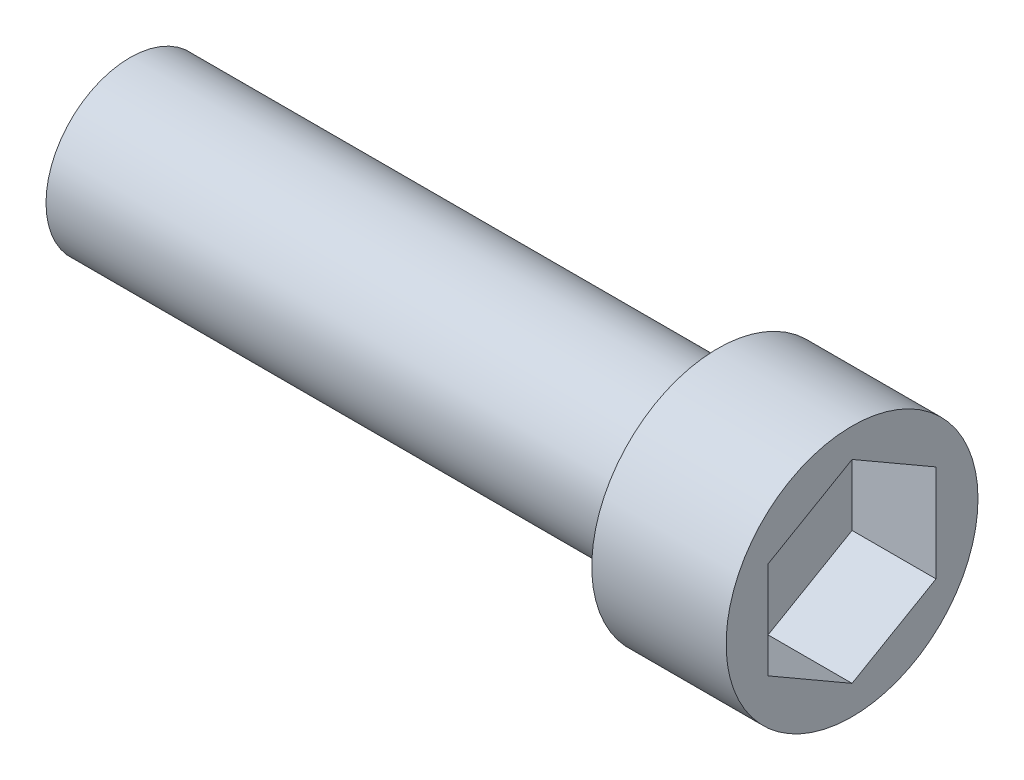
from build123d import *

# Parameters (mm, degrees)
SKETCH1_R           = 7.5
BOSS_EXTRUDE1_DEPTH = 8
CUT_EXTRUDE1_DEPTH  = 5
SKETCH3_R           = 5
SKETCH3_R_2         = 3.31
EXTRUDE_THIN1_DEPTH = 35


with BuildPart() as part:
    # Sketch1 → Boss-Extrude1 (new body)
    with BuildSketch(Plane(origin=(0, 0, 0), x_dir=(0, 0, -1), z_dir=(1, 0, 0))):
        Circle(SKETCH1_R)
    extrude(amount=BOSS_EXTRUDE1_DEPTH)

    # Sketch2 → Cut-Extrude1 (cut)
    with BuildSketch(Plane(origin=(8, 0, 0), x_dir=(0, 0, -1), z_dir=(1, 0, 0))):
        Polygon((0, -5.773502692), (5, -2.886751346), (5, 2.886751346), (0, 5.773502692), (-5, 2.886751346), (-5, -2.886751346), align=None)
    extrude(amount=-CUT_EXTRUDE1_DEPTH, mode=Mode.SUBTRACT)

    # Sketch3 → Extrude-Thin1 (add)
    with BuildSketch(Plane.ZY):
        Circle(SKETCH3_R)
        Circle(SKETCH3_R_2, mode=Mode.SUBTRACT)
    extrude(amount=EXTRUDE_THIN1_DEPTH)


solid = part.part
